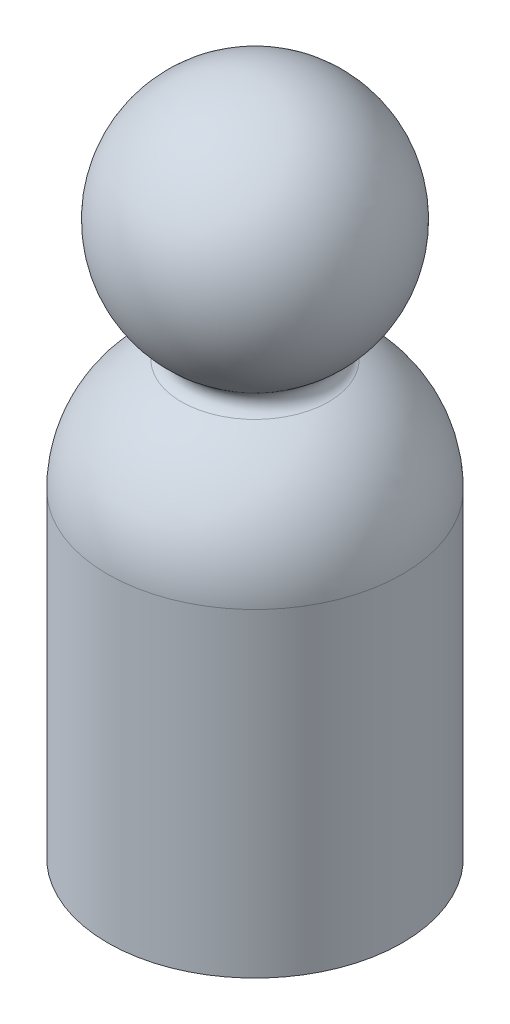
from build123d import *


with BuildPart() as part:
    # Sketch1 → Revolve1 (revolve)
    with BuildSketch(Plane.XY):
        with BuildLine():
            Line((0, 0), (12, 0))
            Line((12, 0), (12, 26))
            ThreePointArc((12, 26), (10.366600265, 31.477225575), (6, 35.16515139))
            ThreePointArc((6, 35.16515139), (5.405478421, 35.977135052), (5.818181818, 36.894985411))
            ThreePointArc((5.818181818, 36.894985411), (9.521866628, 48.083342949), (0, 55.028174227))
            Line((0, 55.028174227), (0, 0))
        make_face()
    revolve(axis=Axis((0, 0, 0), (0, 1, 0)))


solid = part.part
